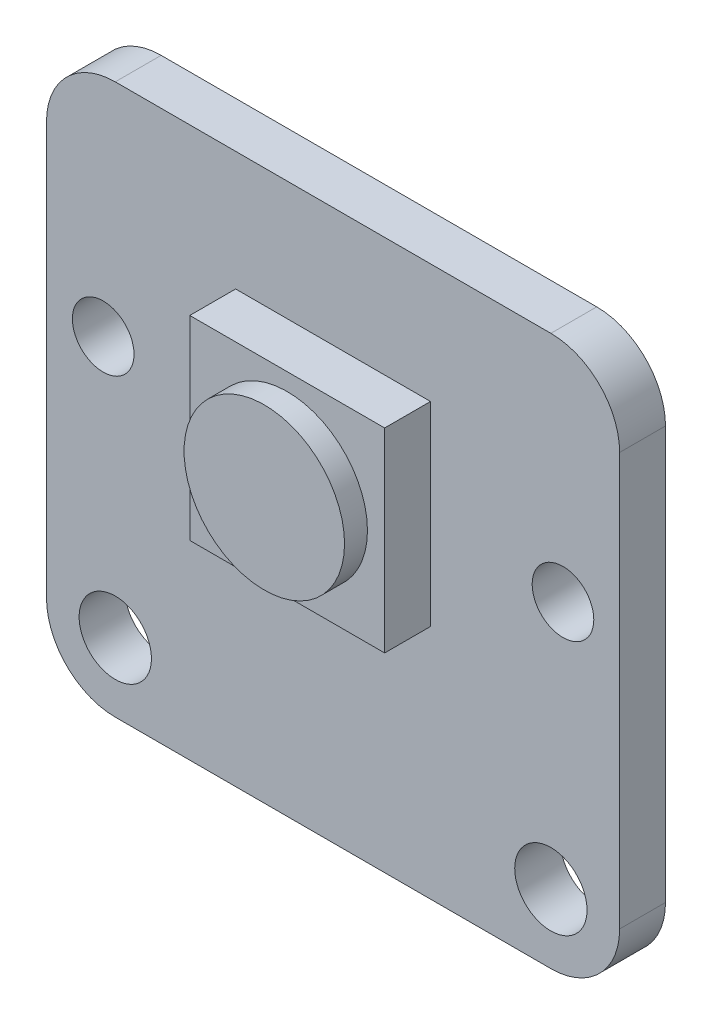
from build123d import *

# Parameters (mm, degrees)
SKETCH_1_W          = 25
SKETCH_1_H          = 24
EXTRUDE_1_DEPTH     = 2
SKETCH_2_W          = 8.5
SKETCH_2_H          = 8.5
EXTRUDE_2_DEPTH     = 2
SKETCH_3_R          = 3.5
EXTRUDE_3_DEPTH     = 1
FILLET_1_R          = 3
FILLET_2_R          = 3
FILLET_3_R          = 3
FILLET_4_R          = 3
SKETCH_5_R          = 1.34400515
SKETCH_5_R_2        = 1.577179003
CUT_EXTRUDE_1_DEPTH = 21


with BuildPart() as part:
    # 스케치1 → 보스-돌출1 (new body)
    with BuildSketch(Plane.XY):
        Rectangle(SKETCH_1_W, SKETCH_1_H)
    extrude(amount=EXTRUDE_1_DEPTH)

    # 스케치2 → 보스-돌출2 (add)
    with BuildSketch(Plane.XY.offset(2)):
        with Locations((0, 2.55)):
            Rectangle(SKETCH_2_W, SKETCH_2_H)
    extrude(amount=EXTRUDE_2_DEPTH)

    # 스케치3 → 보스-돌출3 (add)
    with BuildSketch(Plane.XY.offset(4)):
        with Locations((0, 2.55)):
            Circle(SKETCH_3_R)
    extrude(amount=EXTRUDE_3_DEPTH)

    # 필렛1
    fillet_1_edges = [part.edges().sort_by_distance(p)[0] for p in [
        (-12.5, -12, 1),
    ]]
    fillet(fillet_1_edges, radius=FILLET_1_R)

    # 필렛2
    fillet_2_edges = [part.edges().sort_by_distance(p)[0] for p in [
        (-12.5, 12, 1),
    ]]
    fillet(fillet_2_edges, radius=FILLET_2_R)

    # 필렛3
    fillet_3_edges = [part.edges().sort_by_distance(p)[0] for p in [
        (12.5, 12, 1),
    ]]
    fillet(fillet_3_edges, radius=FILLET_3_R)

    # 필렛4
    fillet_4_edges = [part.edges().sort_by_distance(p)[0] for p in [
        (12.5, -12, 1),
    ]]
    fillet(fillet_4_edges, radius=FILLET_4_R)

    # 스케치5 → 컷-돌출1 (cut)
    with BuildSketch(Plane.XY.offset(2)):
        with Locations((-10.027820436, 2.115243373)):
            Circle(SKETCH_5_R)
        with Locations((10.027820436, 2.115243373)):
            Circle(SKETCH_5_R)
        with Locations((-9.5, -9)):
            Circle(SKETCH_5_R_2)
        with Locations((9.5, -9)):
            Circle(SKETCH_5_R_2)
    extrude(amount=-CUT_EXTRUDE_1_DEPTH, mode=Mode.SUBTRACT)


solid = part.part
